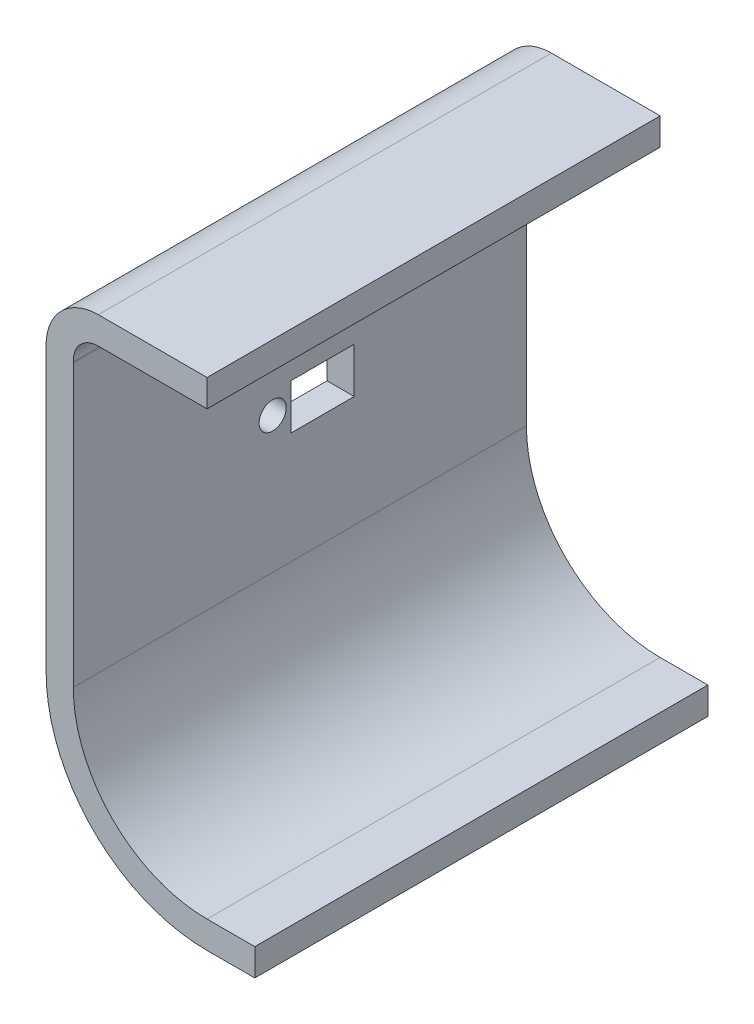
from build123d import *

# Parameters (mm, degrees)
BOSS_EXTRUDE4_DEPTH = 50
SKETCH5_R           = 1.5
SKETCH5_W           = 7
SKETCH5_H           = 5
SKETCH5_W_2         = 12
CUT_EXTRUDE1_DEPTH  = 65.314778352


with BuildPart() as part:
    # Sketch4 → Boss-Extrude4 (new body)
    with BuildSketch(Plane.XY):
        with BuildLine():
            Line((-1.5, -15.5), (-1.5, 15.5))
            ThreePointArc((-1.5, 15.5), (0.101399131, 19.727512771), (4.260080705, 21.5))
            Line((4.260080705, 21.5), (16.260080705, 21.5))
            Line((16.260080705, 21.5), (16.260080705, 18.5))
            Line((16.260080705, 18.5), (4.260080705, 18.5))
            ThreePointArc((4.260080705, 18.5), (2.265546552, 17.649902138), (1.497503795, 15.622356038))
            Line((1.497503795, 15.622356038), (1.5, 15.5))
            Line((1.5, 15.5), (1.5, -15.5))
            ThreePointArc((1.5, -15.5), (5.823127548, -25.936953157), (16.260080705, -30.260080705))
            Line((16.260080705, -30.260080705), (21.525154636, -30.260080705))
            Line((21.525154636, -30.260080705), (21.525154636, -33.260080705))
            Line((21.525154636, -33.260080705), (16.260080705, -33.260080705))
            ThreePointArc((16.260080705, -33.260080705), (3.701807204, -28.058273501), (-1.5, -15.5))
        make_face()
    extrude(amount=BOSS_EXTRUDE4_DEPTH)

    # Sketch5 → Cut-Extrude1 (cut, through all)
    with BuildSketch(Plane.ZY.offset(1.5)):
        with Locations((28, -0.5)):
            Circle(SKETCH5_R)
        with Locations((22.5, -0.7)):
            Rectangle(SKETCH5_W, SKETCH5_H)
        with Locations((26, 8.3)):
            Rectangle(SKETCH5_W_2, SKETCH5_H)
    extrude(amount=-CUT_EXTRUDE1_DEPTH, mode=Mode.SUBTRACT)


solid = part.part
